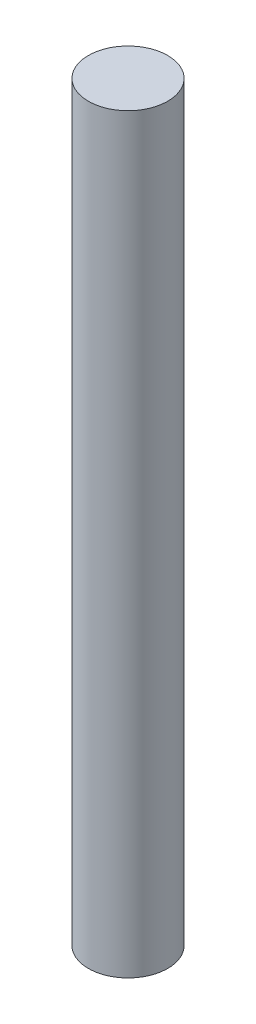
from build123d import *

# Parameters (mm, degrees)
SKETCH1_R           = 1.1938
BOSS_EXTRUDE1_DEPTH = 22.606


with BuildPart() as part:
    # Sketch1 → Boss-Extrude1 (new body)
    with BuildSketch(Plane(origin=(0, 0, 0), x_dir=(1, 0, 0), z_dir=(0, 1, 0))):
        with Locations(Location((0, 0, 0), (0, 0, 90))):
            Circle(SKETCH1_R)
    extrude(amount=BOSS_EXTRUDE1_DEPTH)


solid = part.part
